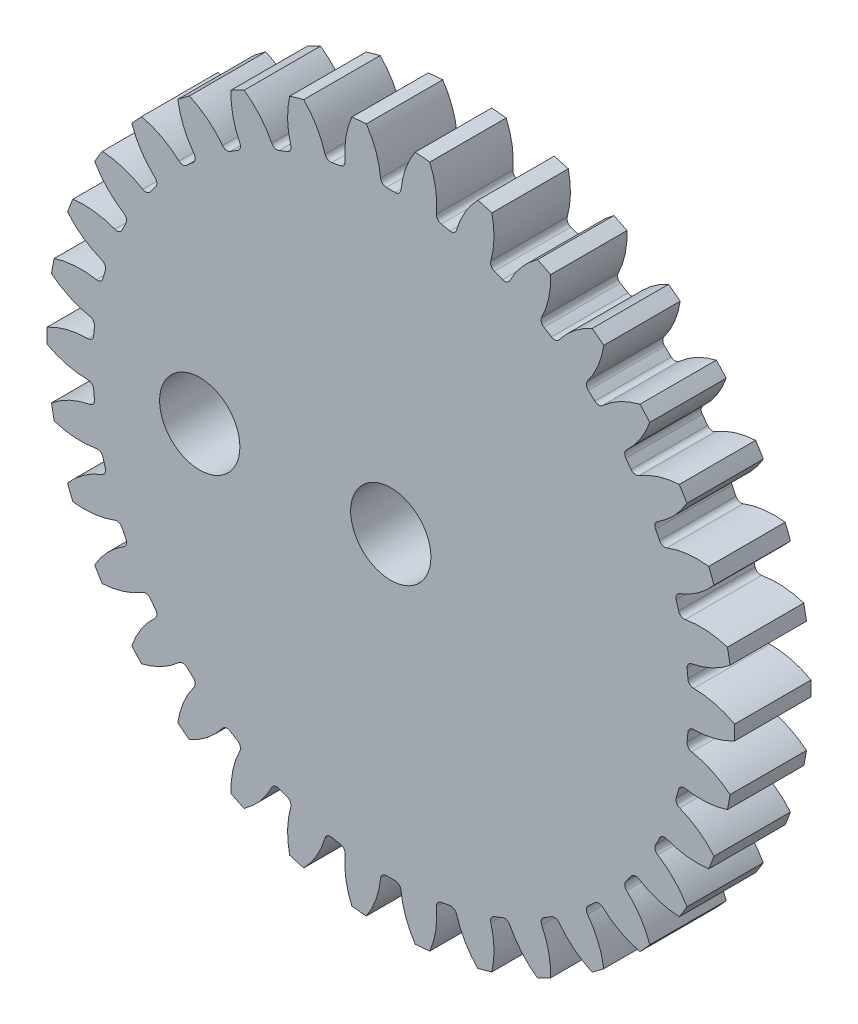
from build123d import *

# Parameters (mm, degrees)
SKETCH1_R                = 9
BOSS_EXTRUDE1_DEPTH      = 1
CUT_EXTRUDE1_DEPTH       = 13.767145335
FILLET1_R                = 0.15
CIRPATTERN1_COUNT        = 34
FILLET1_OF_CIRPATTERN1_R = 0.15
CUT_EXTRUDE2_DEPTH       = 13.868196522
CUT_EXTRUDE2_DEPTH_BACK  = 13.868196522
SKETCH4_R                = 1.05
SKETCH5_R                = 1.05
CUT_EXTRUDE3_DEPTH       = 10


with BuildPart() as part:
    # Sketch1 → Boss-Extrude1 (new, symmetric)
    with BuildSketch(Plane.XY):
        Circle(SKETCH1_R)
    extrude(amount=BOSS_EXTRUDE1_DEPTH, both=True)

    # Sketch3 → Cut-Extrude1 (cut, symmetric)
    with BuildSketch(Plane.XY):
        with BuildLine():
            ThreePointArc((0.258080034, 7.79572926), (0, 7.8), (-0.258080034, 7.79572926))
            ThreePointArc((-0.258080034, 7.79572926), (-0.365908032, 8.413333141), (-0.639939263, 8.977219934))
            ThreePointArc((-0.639939263, 8.977219934), (0, 9), (0.639939263, 8.977219934))
            ThreePointArc((0.639939263, 8.977219934), (0.365908032, 8.413333141), (0.258080034, 7.79572926))
        make_face()
    cut_extrude1 = extrude(amount=CUT_EXTRUDE1_DEPTH, both=True, mode=Mode.SUBTRACT)

    # Fillet1
    fillet1_edges = [part.edges().sort_by_distance(p)[0] for p in [
        (0.258080034, 7.79572926, 0),
        (-0.258080034, 7.79572926, 0),
    ]]
    fillet(fillet1_edges, radius=FILLET1_R)

    # CirPattern1: Cut-Extrude1 ×34 about axis
    cirpattern1_axis = Axis((0, 0, 0), (0, 0, 1))
    for i in range(1, CIRPATTERN1_COUNT):
        add(cut_extrude1.rotate(cirpattern1_axis, i * 360 / CIRPATTERN1_COUNT), mode=Mode.SUBTRACT)

    # Fillet1 of CirPattern1
    fillet1_of_cirpattern1_edges = [part.edges().sort_by_distance(p)[0] for p in [
        (-1.178775761, 7.710414237, 0),
        (-1.686147224, 7.615570073, 0),
        (-2.575489762, 7.362530305, 0),
        (-3.056794692, 7.176071781, 0),
        (-3.884498548, 6.763924233, 0),
        (-4.323346683, 6.492200972, 0),
        (-5.061225395, 5.934980834, 0),
        (-5.442672288, 5.587246045, 0),
        (-6.065598281, 4.903928781, 0),
        (-6.376654216, 4.492024154, 0),
        (-6.863414493, 3.705879315, 0),
        (-7.093486833, 3.243831769, 0),
        (-7.427505356, 2.381630574, 0),
        (-7.568759263, 1.885174584, 0),
        (-7.738661432, 0.97627826, 0),
        (-7.786286675, 0.462320039, 0),
        (-7.786286675, -0.462320039, 0),
        (-7.738661432, -0.97627826, 0),
        (-7.568759263, -1.885174584, 0),
        (-7.427505356, -2.381630574, 0),
        (-7.093486833, -3.243831769, 0),
        (-6.863414493, -3.705879315, 0),
        (-6.376654216, -4.492024154, 0),
        (-6.065598281, -4.903928781, 0),
        (-5.442672288, -5.587246045, 0),
        (-5.061225395, -5.934980834, 0),
        (-4.323346683, -6.492200972, 0),
        (-3.884498548, -6.763924233, 0),
        (-3.056794692, -7.176071781, 0),
        (-2.575489762, -7.362530305, 0),
        (-1.686147224, -7.615570073, 0),
        (-1.178775761, -7.710414237, 0),
        (-0.258080034, -7.79572926, 0),
        (0.258080034, -7.79572926, 0),
        (1.178775761, -7.710414237, 0),
        (1.686147224, -7.615570073, 0),
        (2.575489762, -7.362530305, 0),
        (3.056794692, -7.176071781, 0),
        (3.884498548, -6.763924233, 0),
        (4.323346683, -6.492200972, 0),
        (5.061225395, -5.934980834, 0),
        (5.442672288, -5.587246045, 0),
        (6.065598281, -4.903928781, 0),
        (6.376654216, -4.492024154, 0),
        (6.863414493, -3.705879315, 0),
        (7.093486833, -3.243831769, 0),
        (7.427505356, -2.381630574, 0),
        (7.568759263, -1.885174584, 0),
        (7.738661432, -0.97627826, 0),
        (7.786286675, -0.462320039, 0),
        (7.786286675, 0.462320039, 0),
        (7.738661432, 0.97627826, 0),
        (7.568759263, 1.885174584, 0),
        (7.427505356, 2.381630574, 0),
        (7.093486833, 3.243831769, 0),
        (6.863414493, 3.705879315, 0),
        (6.376654216, 4.492024154, 0),
        (6.065598281, 4.903928781, 0),
        (5.442672288, 5.587246045, 0),
        (5.061225395, 5.934980834, 0),
        (4.323346683, 6.492200972, 0),
        (3.884498548, 6.763924233, 0),
        (3.056794692, 7.176071781, 0),
        (2.575489762, 7.362530305, 0),
        (1.686147224, 7.615570073, 0),
        (1.178775761, 7.710414237, 0),
    ]]
    fillet(fillet1_of_cirpattern1_edges, radius=FILLET1_OF_CIRPATTERN1_R)

    # Sketch4 → Cut-Extrude2 (cut, two sides: drawn at the far end of the back side and taken through both)
    with BuildSketch(Plane.XY.offset(1).offset(-CUT_EXTRUDE2_DEPTH_BACK)):
        Circle(SKETCH4_R)
    extrude(amount=CUT_EXTRUDE2_DEPTH + CUT_EXTRUDE2_DEPTH_BACK, mode=Mode.SUBTRACT)

    # Sketch5 → Cut-Extrude3 (cut)
    with BuildSketch(Plane.XY.offset(1)):
        with Locations((-5, 0)):
            Circle(SKETCH5_R)
    extrude(amount=-CUT_EXTRUDE3_DEPTH, mode=Mode.SUBTRACT)


solid = part.part
